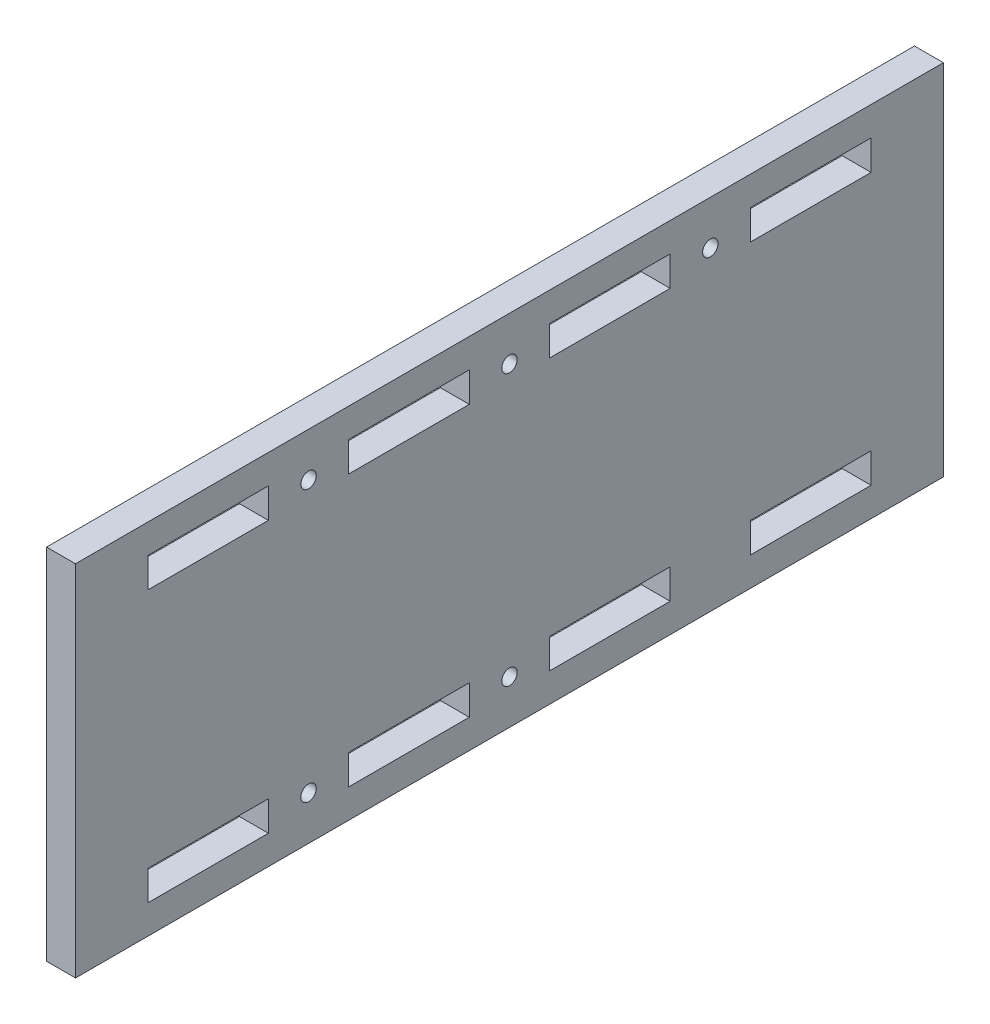
from build123d import *

# Parameters (mm, degrees)
SKETCH1_W           = 180
SKETCH1_H           = 74.4
SKETCH1_R           = 1.6
SKETCH1_W_2         = 25
SKETCH1_H_2         = 6.2
BOSS_EXTRUDE1_DEPTH = 6


with BuildPart() as part:
    # Sketch1 → Boss-Extrude1 (new body)
    with BuildSketch(Plane(origin=(0, 0, 0), x_dir=(0, 0, -1), z_dir=(1, 0, 0))):
        Rectangle(SKETCH1_W, SKETCH1_H)
        with Locations((-41.666666667, -28.1)):
            Circle(SKETCH1_R, mode=Mode.SUBTRACT)
        with Locations((0, -28.1)):
            Circle(SKETCH1_R, mode=Mode.SUBTRACT)
        with Locations((-41.666666667, 28.1)):
            Circle(SKETCH1_R, mode=Mode.SUBTRACT)
        with Locations((0, 28.1)):
            Circle(SKETCH1_R, mode=Mode.SUBTRACT)
        with Locations(Location((41.666666667, 28.1, 0), (0, 0, 180))):
            Circle(SKETCH1_R, mode=Mode.SUBTRACT)
        with Locations((-20.833333333, -28.1)):
            Rectangle(SKETCH1_W_2, SKETCH1_H_2, mode=Mode.SUBTRACT)
        with Locations((-62.5, -28.1)):
            Rectangle(SKETCH1_W_2, SKETCH1_H_2, mode=Mode.SUBTRACT)
        with Locations((20.833333333, -28.1)):
            Rectangle(SKETCH1_W_2, SKETCH1_H_2, mode=Mode.SUBTRACT)
        with Locations((62.5, -28.1)):
            Rectangle(SKETCH1_W_2, SKETCH1_H_2, mode=Mode.SUBTRACT)
        with Locations((-62.5, 28.1)):
            Rectangle(SKETCH1_W_2, SKETCH1_H_2, mode=Mode.SUBTRACT)
        with Locations((-20.833333333, 28.1)):
            Rectangle(SKETCH1_W_2, SKETCH1_H_2, mode=Mode.SUBTRACT)
        with Locations((20.833333333, 28.1)):
            Rectangle(SKETCH1_W_2, SKETCH1_H_2, mode=Mode.SUBTRACT)
        with Locations((62.5, 28.1)):
            Rectangle(SKETCH1_W_2, SKETCH1_H_2, mode=Mode.SUBTRACT)
    extrude(amount=BOSS_EXTRUDE1_DEPTH)


solid = part.part
